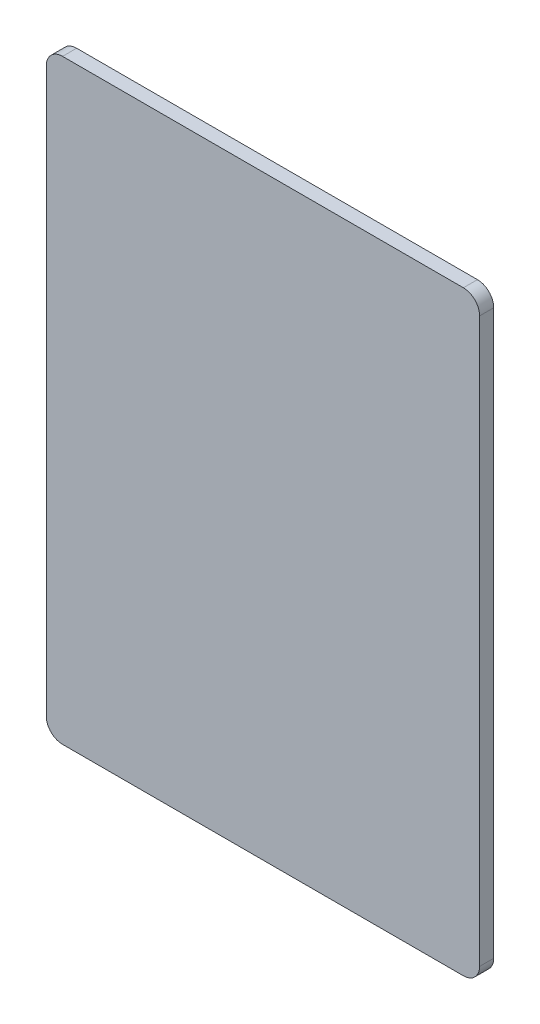
from build123d import *

# Parameters (mm, degrees)
SKETCH1_W           = 55
SKETCH1_H           = 40
BOSS_EXTRUDE1_DEPTH = 1.3
FILLET1_R           = 1.5


with BuildPart() as part:
    # Sketch1 → Boss-Extrude1 (new body)
    with BuildSketch(Plane(origin=(0, 0, 0), x_dir=(0, 1, 0), z_dir=(0, 0, 1))):
        Rectangle(SKETCH1_W, SKETCH1_H)
    extrude(amount=BOSS_EXTRUDE1_DEPTH)

    # Fillet1
    fillet1_edges = [part.edges().sort_by_distance(p)[0] for p in [
        (20, 27.5, 0.65),
        (20, -27.5, 0.65),
        (-20, -27.5, 0.65),
        (-20, 27.5, 0.65),
    ]]
    fillet(fillet1_edges, radius=FILLET1_R)


solid = part.part
